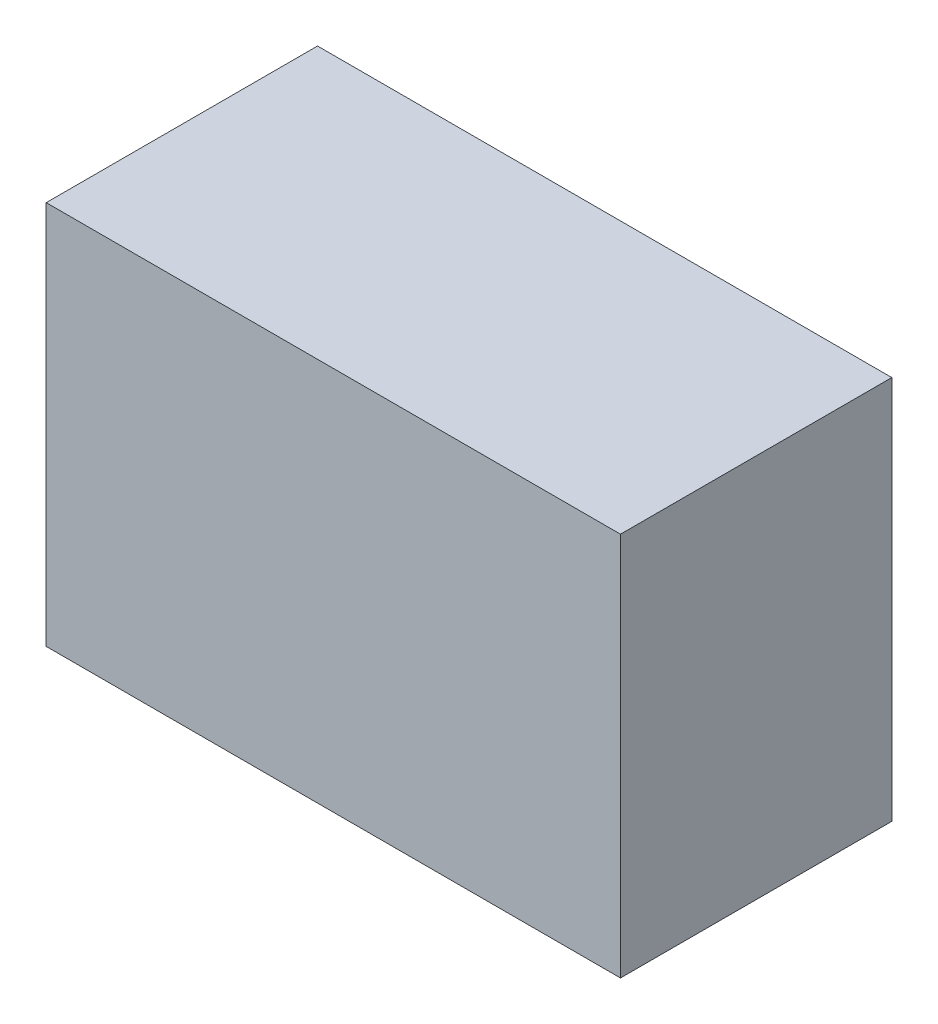
from build123d import *

# Parameters (mm, degrees)
SKETCH1_W           = 63.5
SKETCH1_H           = 42.5
BOSS_EXTRUDE1_DEPTH = 30


with BuildPart() as part:
    # Sketch1 → Boss-Extrude1 (new body)
    with BuildSketch(Plane.XY):
        Rectangle(SKETCH1_W, SKETCH1_H)
    extrude(amount=BOSS_EXTRUDE1_DEPTH)


solid = part.part
